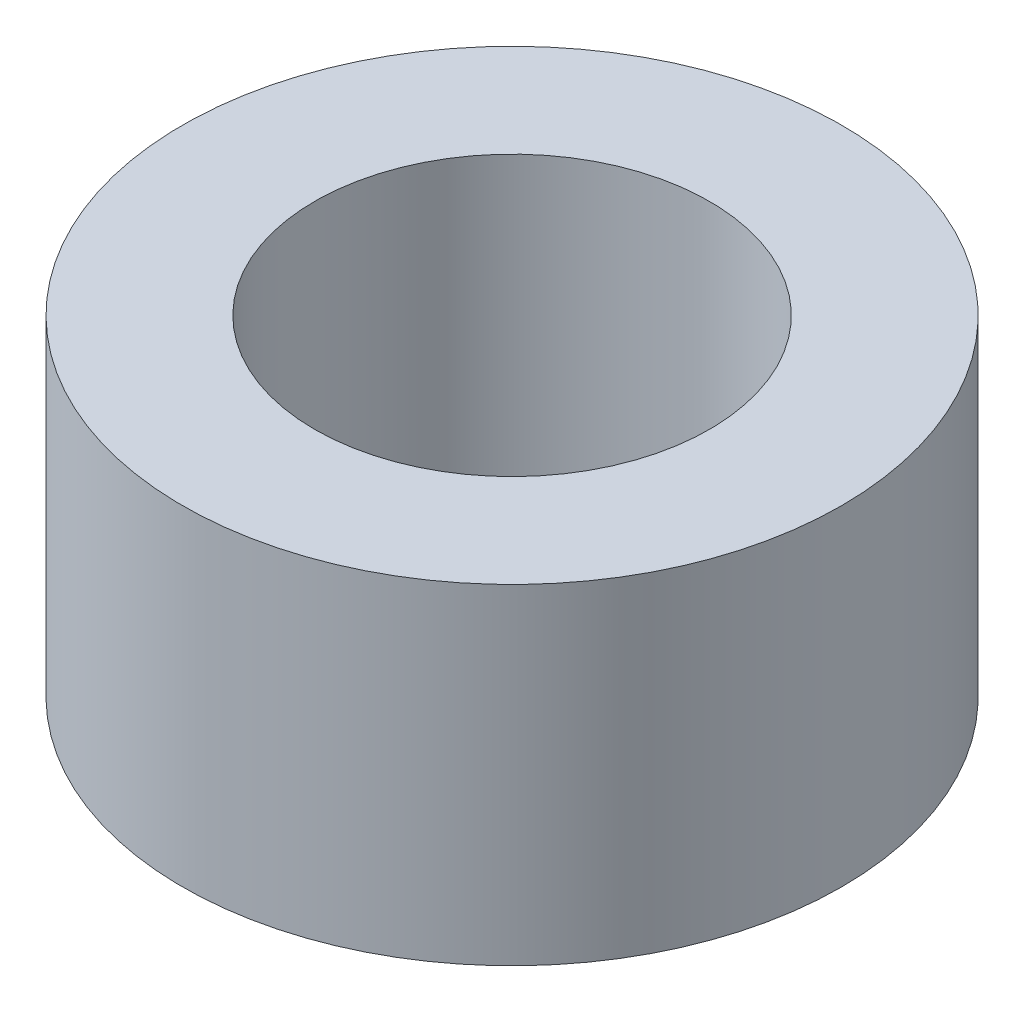
from build123d import *

# Parameters (mm, degrees)
SKETCH1_R           = 2.495
SKETCH1_R_2         = 1.495
EXTRUDE_THIN1_DEPTH = 2.5


with BuildPart() as part:
    # Sketch1 → Extrude-Thin1 (new body)
    with BuildSketch(Plane(origin=(0, 0, 0), x_dir=(1, 0, 0), z_dir=(0, 1, 0))):
        Circle(SKETCH1_R)
        Circle(SKETCH1_R_2, mode=Mode.SUBTRACT)
    extrude(amount=EXTRUDE_THIN1_DEPTH)


solid = part.part
